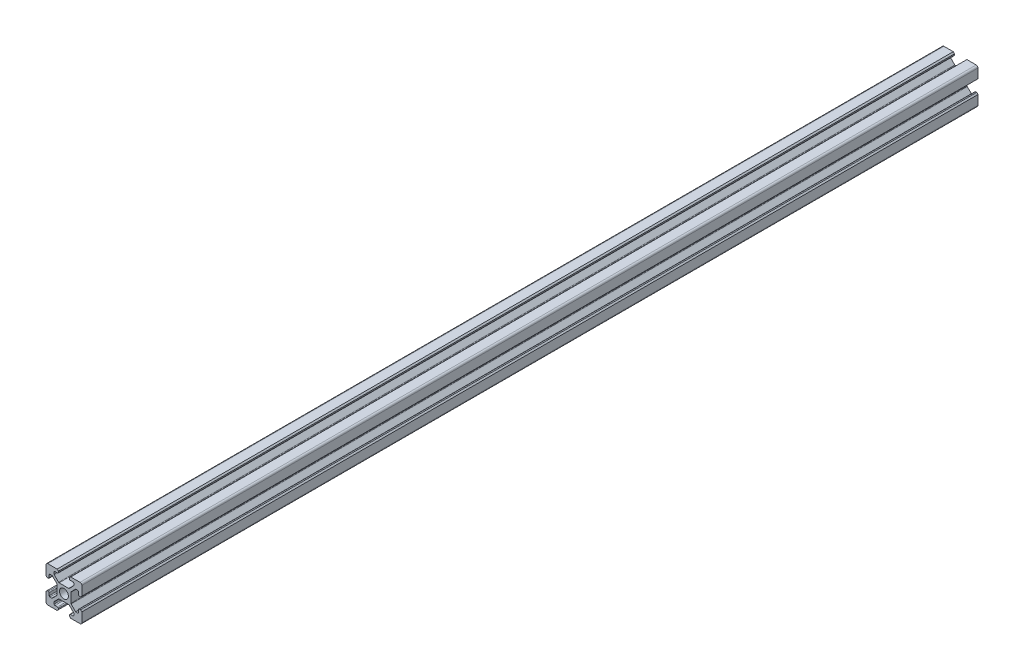
from build123d import *

# Parameters (mm, degrees)
SKETCH1_R           = 2.5
BOSS_EXTRUDE1_DEPTH = 250
FILLET1_R           = 0.5
FILLET2_R           = 0.5
FILLET3_R           = 1


with BuildPart() as part:
    # Sketch1 → Boss-Extrude1 (new, symmetric)
    with BuildSketch(Plane.XY):
        Polygon((3.9, -2.839339828), (6.560660172, -5.5), (8.200660172, -5.5), (8.200660172, -3.1), (9.3, -3.1), (10, -3.8), (10, -10), (3.8, -10), (3.1, -9.3), (3.1, -8.200660172), (5.5, -8.200660172), (5.5, -6.560660172), (2.839339828, -3.9), (-2.839339828, -3.9), (-5.5, -6.560660172), (-5.5, -8.200660172), (-3.1, -8.200660172), (-3.1, -9.3), (-3.8, -10), (-10, -10), (-10, -3.8), (-9.3, -3.1), (-8.200660172, -3.1), (-8.200660172, -5.5), (-6.560660172, -5.5), (-3.9, -2.839339828), (-3.9, 2.839339828), (-6.560660172, 5.5), (-8.200660172, 5.5), (-8.200660172, 3.1), (-9.3, 3.1), (-10, 3.8), (-10, 10), (-3.8, 10), (-3.1, 9.3), (-3.1, 8.200660172), (-5.5, 8.200660172), (-5.5, 6.560660172), (-2.839339828, 3.9), (2.839339828, 3.9), (5.5, 6.560660172), (5.5, 8.200660172), (3.1, 8.200660172), (3.1, 9.3), (3.8, 10), (10, 10), (10, 3.8), (9.3, 3.1), (8.200660172, 3.1), (8.200660172, 5.5), (6.560660172, 5.5), (3.9, 2.839339828), align=None)
        Circle(SKETCH1_R, mode=Mode.SUBTRACT)
    extrude(amount=BOSS_EXTRUDE1_DEPTH, both=True)

    # Fillet1
    fillet1_edges = [part.edges().sort_by_distance(p)[0] for p in [
        (-2.839339828, 3.9, 0),
        (2.839339828, 3.9, 0),
        (3.9, 2.839339828, 0),
        (3.9, -2.839339828, 0),
        (2.839339828, -3.9, 0),
        (-2.839339828, -3.9, 0),
        (-3.9, -2.839339828, 0),
        (-3.9, 2.839339828, 0),
    ]]
    fillet(fillet1_edges, radius=FILLET1_R)

    # Fillet2
    fillet2_edges = [part.edges().sort_by_distance(p)[0] for p in [
        (-5.5, 6.560660172, 0),
        (5.5, 6.560660172, 0),
        (5.5, 8.200660172, 0),
        (3.1, 8.200660172, 0),
        (8.200660172, 3.1, 0),
        (8.200660172, 5.5, 0),
        (6.560660172, 5.5, 0),
        (6.560660172, -5.5, 0),
        (8.200660172, -5.5, 0),
        (8.200660172, -3.1, 0),
        (3.1, -8.200660172, 0),
        (5.5, -8.200660172, 0),
        (5.5, -6.560660172, 0),
        (-5.5, -6.560660172, 0),
        (-5.5, -8.200660172, 0),
        (-3.1, -8.200660172, 0),
        (-8.200660172, -3.1, 0),
        (-8.200660172, -5.5, 0),
        (-6.560660172, -5.5, 0),
        (-6.560660172, 5.5, 0),
        (-8.200660172, 5.5, 0),
        (-8.200660172, 3.1, 0),
        (-3.1, 8.200660172, 0),
        (-5.5, 8.200660172, 0),
    ]]
    fillet(fillet2_edges, radius=FILLET2_R)

    # Fillet3
    fillet3_edges = [part.edges().sort_by_distance(p)[0] for p in [
        (10, 10, 0),
        (10, -10, 0),
        (-10, -10, 0),
        (-10, 10, 0),
    ]]
    fillet(fillet3_edges, radius=FILLET3_R)


solid = part.part
